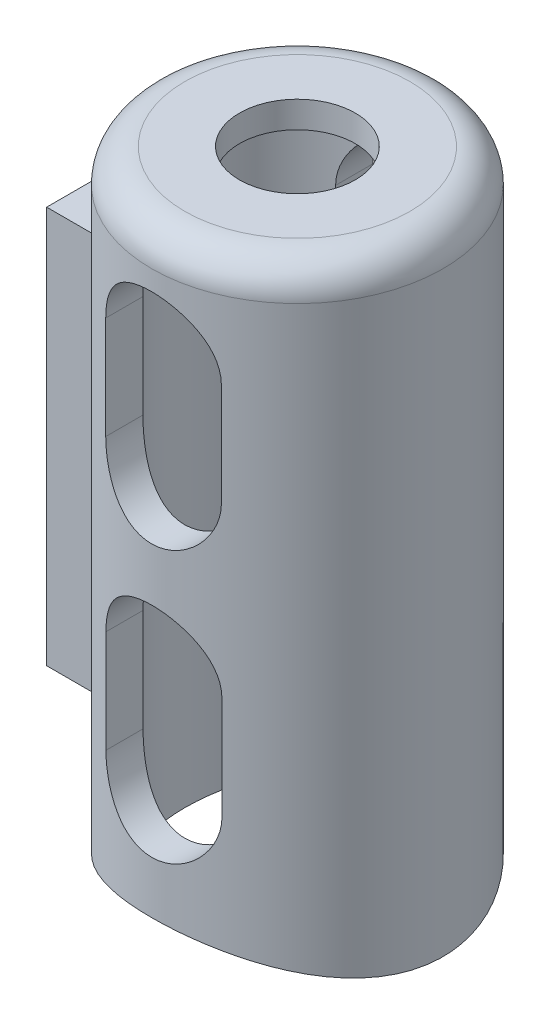
from build123d import *

# Parameters (mm, degrees)
BOSS_EXTRUDE1_DEPTH      = 45.72
BOSS_EXTRUDE1_DEPTH_BACK = 2.54
SKETCH1_R                = 11.176
SKETCH1_R_2              = 8.636
SKETCH2_R                = 10.668
BOSS_EXTRUDE2_DEPTH      = 2.032
CUT_EXTRUDE1_DEPTH       = 49.374831803
CUT_EXTRUDE1_DEPTH_BACK  = 49.374831803
CUT_EXTRUDE2_REACH       = 52.782
SKETCH4_R                = 4.445
BOSS_EXTRUDE3_DEPTH      = 2.032
BOSS_EXTRUDE3_DEPTH_BACK = 2.54
SKETCH5_W                = 12.065
SKETCH5_H                = 30.48
SKETCH6_R                = 3.683
CUT_EXTRUDE3_DEPTH       = 2.286
CUT_EXTRUDE4_DEPTH       = 54.007554634
FILLET1_R                = 2.54


with BuildPart() as part:
    # Sketch1 → Boss-Extrude1 (new, two sides: drawn at the far end of the back side and taken through both)
    with BuildSketch(Plane(origin=(0, 0, 0), x_dir=(1, 0, 0), z_dir=(0, 1, 0)).offset(-BOSS_EXTRUDE1_DEPTH_BACK)):
        with Locations(Location((0, 0, 0), (0, 0, 270))):
            Circle(SKETCH1_R)
        with Locations(Location((0, 0, 0), (0, 0, 270))):
            Circle(SKETCH1_R_2, mode=Mode.SUBTRACT)
    extrude(amount=BOSS_EXTRUDE1_DEPTH + BOSS_EXTRUDE1_DEPTH_BACK)

    # Sketch2 → Boss-Extrude2 (add)
    with BuildSketch(Plane(origin=(0, 45.72, 0), x_dir=(1, 0, 0), z_dir=(0, 1, 0))):
        Circle(SKETCH2_R)
    extrude(amount=-BOSS_EXTRUDE2_DEPTH)

    # Sketch3 → Cut-Extrude1 (cut, two sides: drawn at the far end of the back side and taken through both)
    with BuildSketch(Plane.XY.offset(-CUT_EXTRUDE1_DEPTH_BACK)):
        with BuildLine():
            Line((4.429766635, 37.211), (4.429766635, 29.336942899))
            ThreePointArc((4.429766635, 29.336942899), (-0.015233365, 24.891942899), (-4.460233365, 29.336942899))
            Line((-4.460233365, 29.336942899), (-4.460233365, 37.211))
            ThreePointArc((-4.460233365, 37.211), (-0.015233365, 41.656), (4.429766635, 37.211))
        make_face()
        with BuildLine():
            Line((-4.429766635, 8.509), (-4.429766635, 16.383057101))
            ThreePointArc((-4.429766635, 16.383057101), (0.015233365, 20.828057101), (4.460233365, 16.383057101))
            Line((4.460233365, 16.383057101), (4.460233365, 8.509))
            ThreePointArc((4.460233365, 8.509), (0.015233365, 4.064), (-4.429766635, 8.509))
        make_face()
    extrude(amount=CUT_EXTRUDE1_DEPTH + CUT_EXTRUDE1_DEPTH_BACK, mode=Mode.SUBTRACT)

    # Sketch4 → Cut-Extrude2 (cut, up to next)
    with BuildSketch(Plane(origin=(0, 45.72, 0), x_dir=(1, 0, 0), z_dir=(0, 1, 0)), mode=Mode.PRIVATE) as cut_extrude2_sk1:
        with Locations(Location((0, 0, 0), (0, 0, 270))):
            Circle(SKETCH4_R)
    cut_extrude2_tool1 = extrude(cut_extrude2_sk1.sketch, amount=-CUT_EXTRUDE2_REACH, mode=Mode.PRIVATE) & part.part
    add(cut_extrude2_tool1.solids().sort_by_distance((0, 45.72, 0))[0], mode=Mode.SUBTRACT)

    # Sketch5 → Boss-Extrude3 (add, two sides: drawn at the far end of the back side and taken through both)
    with BuildSketch(Plane(origin=(-10.668, 0, 0), x_dir=(0, 0, -1), z_dir=(1, 0, 0)).offset(-BOSS_EXTRUDE3_DEPTH_BACK)):
        with Locations((0, 22.86)):
            Rectangle(SKETCH5_W, SKETCH5_H)
    extrude(amount=BOSS_EXTRUDE3_DEPTH + BOSS_EXTRUDE3_DEPTH_BACK)

    # Sketch6 → Cut-Extrude3 (cut)
    with BuildSketch(Plane.ZY.offset(13.208)):
        with Locations((0, 22.86)):
            Circle(SKETCH6_R)
    extrude(amount=-CUT_EXTRUDE3_DEPTH, mode=Mode.SUBTRACT)

    # Sketch8 → Cut-Extrude4 (cut, through all)
    with BuildSketch(Plane.ZY.offset(13.208)):
        with BuildLine():
            Line((-13.894688237, -6.768770079), (13.894688237, -6.768770079))
            Line((13.894688237, -6.768770079), (13.894688237, 1.597412227))
            ThreePointArc((13.894688237, 1.597412227), (0, -2.54), (-13.894688237, 1.597412227))
            Line((-13.894688237, 1.597412227), (-13.894688237, -6.768770079))
        make_face()
    extrude(amount=-CUT_EXTRUDE4_DEPTH, mode=Mode.SUBTRACT)

    # Fillet1
    fillet1_edges = [part.edges().sort_by_distance(p)[0] for p in [
        (0, 45.72, -11.176),
    ]]
    fillet(fillet1_edges, radius=FILLET1_R)


solid = part.part
